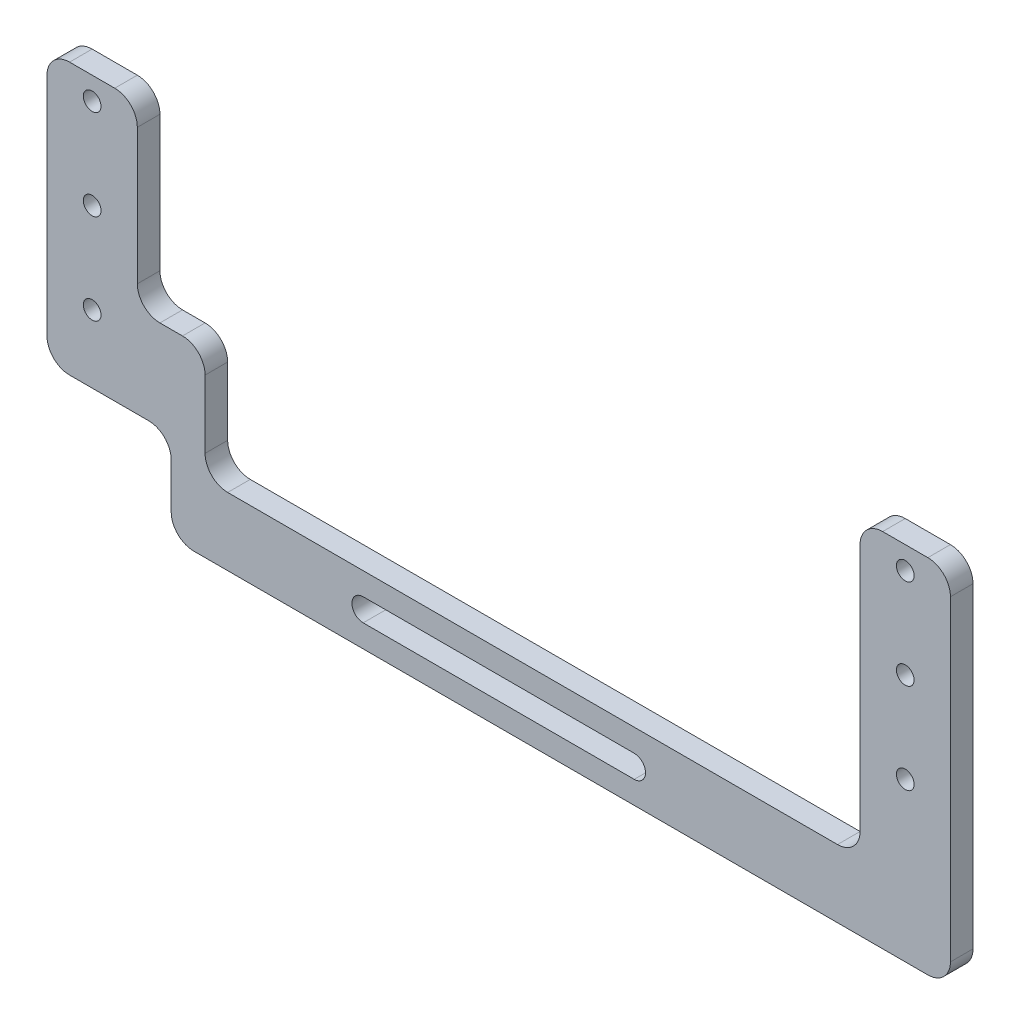
from build123d import *

# Parameters (mm, degrees)
BOSS_EXTRUDE2_DEPTH = 6.35
FILLET1_R           = 6.35
SKETCH2_R           = 2.4892
CUT_EXTRUDE1_DEPTH  = 204.913109234


with BuildPart() as part:
    # Sketch1 → Boss-Extrude2 (new body)
    with BuildSketch(Plane.XY):
        Polygon((51.914761179, 0), (77.314761179, 0), (77.314761179, -101.6), (-141.760238821, -101.6), (-141.760238821, -76.2), (-176.685238821, -76.2), (-176.685238821, 0), (-151.285238821, 0), (-151.285238821, -50.8), (-132.235238821, -50.8), (-132.235238821, -82.55), (51.914761179, -82.55), align=None)
        with BuildLine():
            Line((-87.785238821, -88.9), (-11.585238821, -88.9))
            ThreePointArc((-11.585238821, -88.9), (-8.410238821, -92.075), (-11.585238821, -95.25))
            Line((-11.585238821, -95.25), (-87.785238821, -95.25))
            ThreePointArc((-87.785238821, -95.25), (-90.960238821, -92.075), (-87.785238821, -88.9))
        make_face(mode=Mode.SUBTRACT)
    extrude(amount=BOSS_EXTRUDE2_DEPTH)

    # Fillet1
    fillet1_edges = [part.edges().sort_by_distance(p)[0] for p in [
        (-176.685238821, 0, 3.175),
        (-151.285238821, 0, 3.175),
        (-151.285238821, -50.8, 3.175),
        (-132.235238821, -50.8, 3.175),
        (-132.235238821, -82.55, 3.175),
        (51.914761179, -82.55, 3.175),
        (51.914761179, 0, 3.175),
        (77.314761179, 0, 3.175),
        (77.314761179, -101.6, 3.175),
        (-141.760238821, -101.6, 3.175),
        (-141.760238821, -76.2, 3.175),
        (-176.685238821, -76.2, 3.175),
    ]]
    fillet(fillet1_edges, radius=FILLET1_R)

    # Sketch2 → Cut-Extrude1 (cut, through all)
    with BuildSketch(Plane.XY.offset(6.35)):
        with Locations((64.614761179, -6.35)):
            Circle(SKETCH2_R)
        with Locations((64.614761179, -31.75)):
            Circle(SKETCH2_R)
        with Locations((64.614761179, -57.15)):
            Circle(SKETCH2_R)
        with Locations((-163.985238821, -6.35)):
            Circle(SKETCH2_R)
        with Locations((-163.985238821, -31.75)):
            Circle(SKETCH2_R)
        with Locations((-163.985238821, -57.15)):
            Circle(SKETCH2_R)
    extrude(amount=-CUT_EXTRUDE1_DEPTH, mode=Mode.SUBTRACT)


solid = part.part
